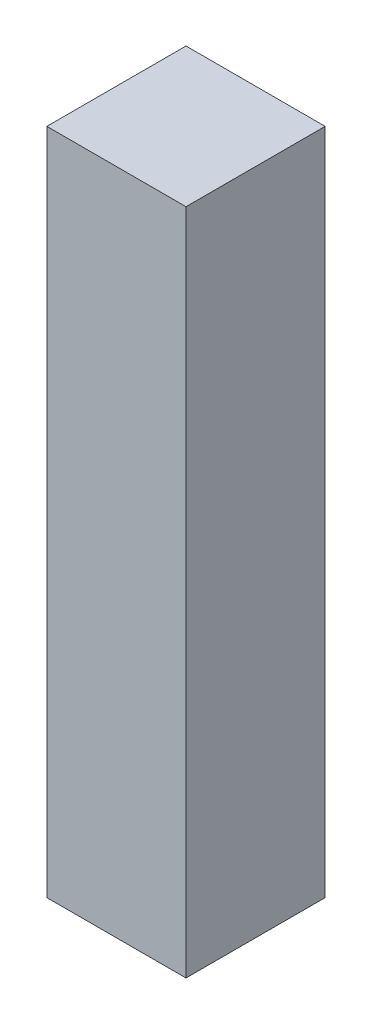
from build123d import *

# Parameters (mm, degrees)
PACK_KAPAK_POSTU_DIKEY_1_START = -380
SKETCH1_W                      = 40
SKETCH1_H                      = 192
PACK_KAPAK_POSTU_DIKEY_1_DEPTH = 40


with BuildPart() as part:
    # Sketch1 → PACK_kapak_postu_dikey_1 (new body)
    with BuildSketch(Plane.XY.offset(PACK_KAPAK_POSTU_DIKEY_1_START)):
        with Locations((350, 604)):
            Rectangle(SKETCH1_W, SKETCH1_H)
    extrude(amount=-PACK_KAPAK_POSTU_DIKEY_1_DEPTH)


solid = part.part
